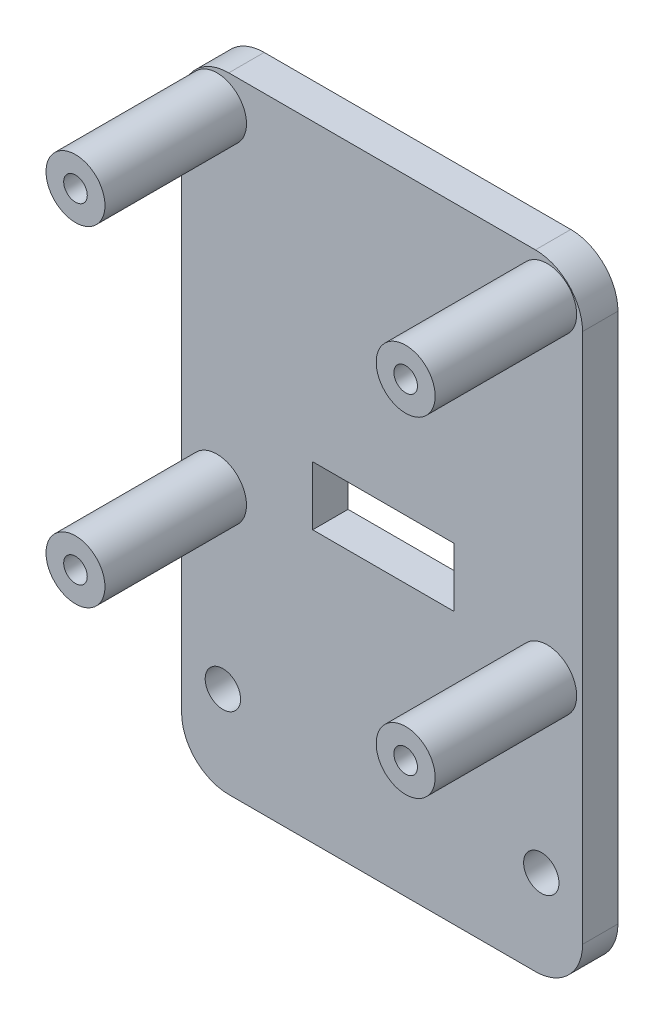
from build123d import *

# Parameters (mm, degrees)
SKETCH_1_W          = 34
SKETCH_1_H          = 38
SKETCH_1_W_2        = 28
SKETCH_1_H_2        = 28
SKETCH_1_H_3        = 15
SKETCH_1_R          = 1.5
EXTRUDE_1_DEPTH     = 3
SKETCH_2_R          = 2.5
EXTRUDE_2_DEPTH     = 12
SKETCH_3_R          = 1
CUT_EXTRUDE_1_DEPTH = 8
FILLET_1_R          = 4
SKETCH_4_W          = 12
SKETCH_4_H          = 5
CUT_EXTRUDE_2_DEPTH = 8


with BuildPart() as part:
    # 草图1 → 凸台-拉伸1 (new body)
    # profile 1 of 3: a face of its own
    with BuildSketch(Plane.XY):
        with Locations((0, 26.5)):
            Rectangle(SKETCH_1_W, SKETCH_1_H)
        with Locations((0, 28.5)):
            Rectangle(SKETCH_1_W_2, SKETCH_1_H_2, mode=Mode.SUBTRACT)
    # profile 2 of 3: a face of its own
    with BuildSketch(Plane.XY):
        with Locations((0, 28.5)):
            Rectangle(SKETCH_1_W_2, SKETCH_1_H_2)
    # profile 3 of 3: a face of its own
    with BuildSketch(Plane.XY):
        Rectangle(SKETCH_1_W, SKETCH_1_H_3)
        with Locations((13.5, 0)):
            Circle(SKETCH_1_R, mode=Mode.SUBTRACT)
        with Locations((-13.5, 0)):
            Circle(SKETCH_1_R, mode=Mode.SUBTRACT)
    extrude(amount=EXTRUDE_1_DEPTH)

    # 草图2 → 凸台-拉伸2 (add)
    with BuildSketch(Plane.XY.offset(3)):
        with Locations((-14, 42.5)):
            Circle(SKETCH_2_R)
        with Locations((14, 42.5)):
            Circle(SKETCH_2_R)
        with Locations((-14, 14.5)):
            Circle(SKETCH_2_R)
        with Locations((14, 14.5)):
            Circle(SKETCH_2_R)
    extrude(amount=EXTRUDE_2_DEPTH)

    # 草图3 → 切除-拉伸1 (cut)
    with BuildSketch(Plane.XY.offset(15)):
        with Locations((-14, 42.5)):
            Circle(SKETCH_3_R)
        with Locations((14, 42.5)):
            Circle(SKETCH_3_R)
        with Locations((-14, 14.5)):
            Circle(SKETCH_3_R)
        with Locations((14, 14.5)):
            Circle(SKETCH_3_R)
    extrude(amount=-CUT_EXTRUDE_1_DEPTH, mode=Mode.SUBTRACT)

    # 圆角1
    fillet_1_edges = [part.edges().sort_by_distance(p)[0] for p in [
        (-17, 45.5, 1.5),
        (17, 45.5, 1.5),
        (17, -7.5, 1.5),
        (-17, -7.5, 1.5),
    ]]
    fillet(fillet_1_edges, radius=FILLET_1_R)

    # 草图4 → 切除-拉伸2 (cut)
    with BuildSketch(Plane.XY.offset(3)):
        with Locations((0.114195125, 18)):
            Rectangle(SKETCH_4_W, SKETCH_4_H)
    extrude(amount=-CUT_EXTRUDE_2_DEPTH, mode=Mode.SUBTRACT)


solid = part.part
